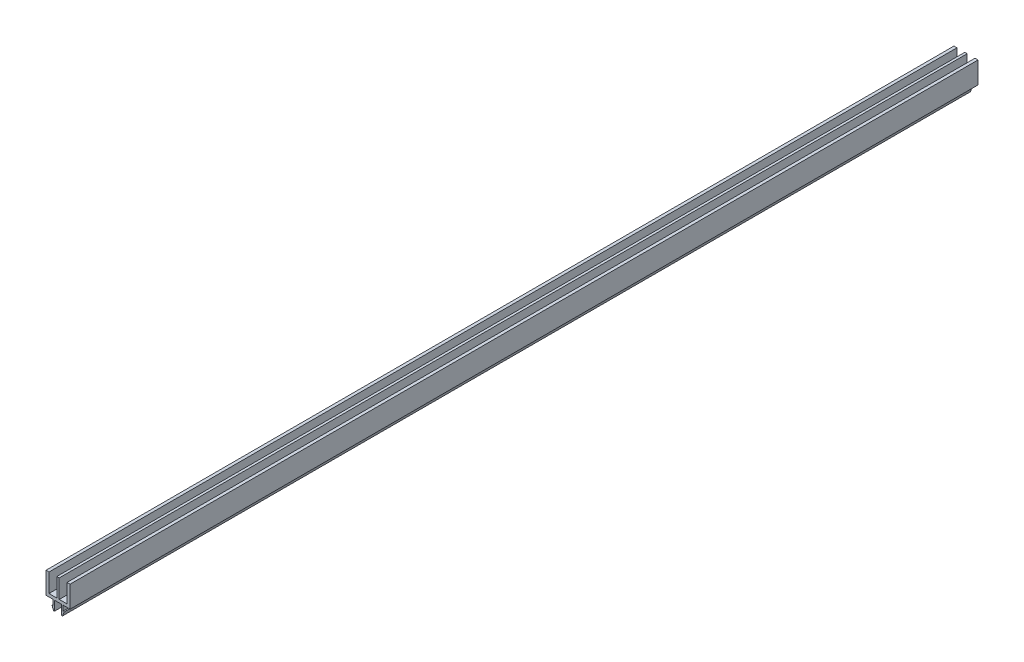
from build123d import *

# Parameters (mm, degrees)
BOSS_EXTRU_1_DEPTH = 754


with BuildPart() as part:
    # Esquisse1 → Boss.-Extru.1 (new body)
    with BuildSketch(Plane.XY.offset(50)):
        Polygon((-1, 2.5), (-7.5, 2.5), (-7.5, 17.999999998), (-10, 17.999999998), (-10, 0), (-4, 0), (-4, -4.5), (-5, -4.5), (-3.75, -8), (-3, -8), (-3, 0), (3, 0), (3, -8), (3.75, -8), (5, -4.5), (4, -4.5), (4, 0), (10, 0), (10, 17.999999998), (7.5, 17.999999998), (7.5, 2.5), (1, 2.5), (1, 17.999999998), (-1, 17.999999998), align=None)
    extrude(amount=-BOSS_EXTRU_1_DEPTH)


solid = part.part
